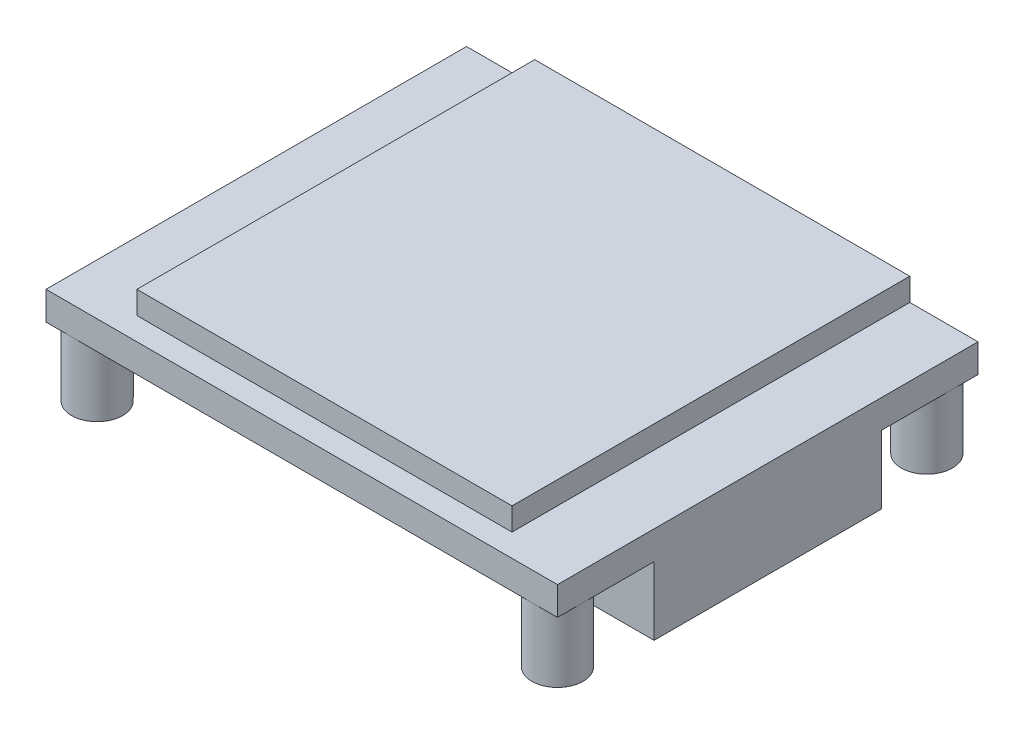
from build123d import *

# Parameters (mm, degrees)
SKETCH_1_W      = 45
SKETCH_1_H      = 37
EXTRUDE_1_DEPTH = 2.5
SKETCH_2_W      = 33
SKETCH_2_H      = 35
EXTRUDE_2_DEPTH = 2
SKETCH_3_R      = 2.25
SKETCH_3_R_2    = 1.5
SKETCH_3_W      = 7
SKETCH_3_H      = 20
EXTRUDE_3_DEPTH = 6


with BuildPart() as part:
    # 草图1 → 凸台-拉伸1 (new body)
    with BuildSketch(Plane(origin=(0, 0, 0), x_dir=(1, 0, 0), z_dir=(0, 1, 0))):
        with Locations((22.5, 18.5)):
            Rectangle(SKETCH_1_W, SKETCH_1_H)
    extrude(amount=EXTRUDE_1_DEPTH)

    # 草图2 → 凸台-拉伸2 (add)
    with BuildSketch(Plane(origin=(0, 2.5, 0), x_dir=(1, 0, 0), z_dir=(0, 1, 0))):
        with Locations((22.5, 19.5)):
            Rectangle(SKETCH_2_W, SKETCH_2_H)
    extrude(amount=EXTRUDE_2_DEPTH)

    # 草图3 → 凸台-拉伸3 (add)
    # profile 1 of 5: a face of its own
    with BuildSketch(Plane.XZ):
        with Locations(Location((42.75, -34.75, 0), (0, 0, 270))):
            Circle(SKETCH_3_R)
        with Locations(Location((42.75, -34.75, 0), (0, 0, 270))):
            Circle(SKETCH_3_R_2, mode=Mode.SUBTRACT)
    # profile 2 of 5: a face of its own
    with BuildSketch(Plane.XZ):
        with Locations(Location((42.75, -2.25, 0), (0, 0, 90))):
            Circle(SKETCH_3_R)
        with Locations(Location((42.75, -2.25, 0), (0, 0, 90))):
            Circle(SKETCH_3_R_2, mode=Mode.SUBTRACT)
    # profile 3 of 5: a face of its own
    with BuildSketch(Plane.XZ):
        with Locations(Location((2.25, -2.25, 0), (0, 0, 90))):
            Circle(SKETCH_3_R)
        with Locations(Location((2.25, -2.25, 0), (0, 0, 270))):
            Circle(SKETCH_3_R_2, mode=Mode.SUBTRACT)
    # profile 4 of 5: a face of its own
    with BuildSketch(Plane.XZ):
        with Locations(Location((2.25, -34.75, 0), (0, 0, 90))):
            Circle(SKETCH_3_R)
        with Locations(Location((2.25, -34.75, 0), (0, 0, 90))):
            Circle(SKETCH_3_R_2, mode=Mode.SUBTRACT)
    # profile 5 of 5: a face of its own
    with BuildSketch(Plane.XZ):
        with Locations((41.5, -18.5)):
            Rectangle(SKETCH_3_W, SKETCH_3_H)
    extrude(amount=EXTRUDE_3_DEPTH)


solid = part.part
